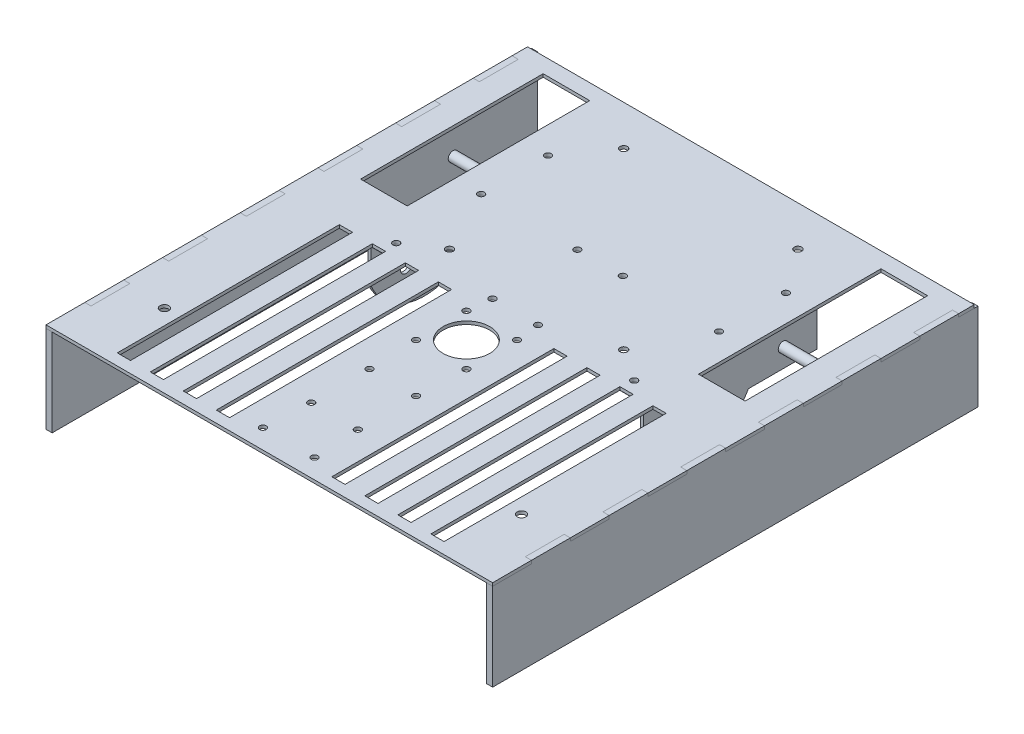
from build123d import *
from build123d.topology import SkipClean

# Parameters (mm, degrees)
SKETCH2_W           = 24
SKETCH2_H           = 94
BOSS_EXTRUDE1_DEPTH = 1.6
BOSS_EXTRUDE2_DEPTH = 3.175
BOSS_EXTRUDE3_DEPTH = 1.6129
SKETCH6_W           = 1.6129
SKETCH6_H           = 89.302300467
SKETCH6_R           = 1.27
SKETCH6_R_2         = 3
SKETCH6_R_3         = 2.55
BOSS_EXTRUDE4_DEPTH = 1.6129
SKETCH7_R           = 1.7
SKETCH7_R_2         = 1.9
SKETCH7_R_3         = 2.25
SKETCH7_W           = 6.810686888
SKETCH7_H           = 114.362783992
CUT_EXTRUDE1_DEPTH  = 10
SKETCH9_R           = 2.5
BOSS_EXTRUDE6_DEPTH = 189


with BuildPart() as part:
    # Sketch2 → Boss-Extrude1 (new body)
    with BuildSketch(Plane(origin=(0, 0, 0), x_dir=(1, 0, 0), z_dir=(0, 1, 0))):
        Polygon((-172.266187111, -88.214102909), (57.733812889, -88.214102909), (57.733812889, -68.214102909), (54.558812889, -68.214102909), (54.558812889, -48.214102909), (57.733812889, -48.214102909), (57.733812889, -28.214102909), (54.558812889, -28.214102909), (54.558812889, -8.214102909), (57.733812889, -8.214102909), (57.733812889, 11.785897091), (54.558812889, 11.785897091), (54.558812889, 31.785897091), (57.733812889, 31.785897091), (57.733812889, 51.785897091), (54.558812889, 51.785897091), (54.558812889, 71.785897091), (57.733812889, 71.785897091), (57.733812889, 91.785897091), (54.558812889, 91.785897091), (54.558812889, 111.785897091), (57.733812889, 111.785897091), (57.733812889, 131.785897091), (54.558812889, 131.785897091), (54.558812889, 151.785897091), (57.733812889, 151.785897091), (57.733812889, 159.785897091), (-172.266187111, 159.785897091), (-172.266187111, 151.785897091), (-169.091187111, 151.785897091), (-169.091187111, 131.785897091), (-172.266187111, 131.785897091), (-172.266187111, 111.785897091), (-169.091187111, 111.785897091), (-169.091187111, 91.785897091), (-172.266187111, 91.785897091), (-172.266187111, 71.785897091), (-169.091187111, 71.785897091), (-169.091187111, 51.785897091), (-172.266187111, 51.785897091), (-172.266187111, 31.785897091), (-169.091187111, 31.785897091), (-169.091187111, 11.785897091), (-172.266187111, 11.785897091), (-172.266187111, -8.214102909), (-169.091187111, -8.214102909), (-169.091187111, -28.214102909), (-172.266187111, -28.214102909), (-172.266187111, -48.214102909), (-169.091187111, -48.214102909), (-169.091187111, -68.214102909), (-172.266187111, -68.214102909), align=None)
        with Locations((29.733812889, 104.785897091)):
            Rectangle(SKETCH2_W, SKETCH2_H, mode=Mode.SUBTRACT)
        with Locations((-144.266187111, 104.785897091)):
            Rectangle(SKETCH2_W, SKETCH2_H, mode=Mode.SUBTRACT)
    extrude(amount=BOSS_EXTRUDE1_DEPTH)


with BuildPart() as body_2:
    # Sketch3 → Boss-Extrude2 (new body)
    with BuildSketch(Plane.ZY.offset(169.091187111)):
        Polygon((68.214102909, 1.6), (68.214102909, 0), (88.214102909, 0), (88.214102909, -45), (-161.732040232, -45), (-161.732040232, 0), (-151.785897091, 0), (-151.785897091, 1.6), (-131.785897091, 1.6), (-131.785897091, 0), (-111.785897091, 0), (-111.785897091, 1.6), (-91.785897091, 1.6), (-91.785897091, 0), (-71.785897091, 0), (-71.785897091, 1.6), (-51.785897091, 1.6), (-51.785897091, 0), (-31.785897091, 0), (-31.785897091, 1.6), (-11.785897091, 1.6), (-11.785897091, 0), (8.214102909, 0), (8.214102909, 1.6), (28.214102909, 1.6), (28.214102909, 0), (48.214102909, 0), (48.214102909, 1.6), align=None)
    extrude(amount=BOSS_EXTRUDE2_DEPTH)


with BuildPart() as body_3:
    # Sketch4 → Boss-Extrude3 (new body)
    with BuildSketch(Plane.XZ):
        Polygon((-128.266187111, -122.812619878), (-128.266187111, -33.510319411), (-110.428738975, -33.510319411), (-110.428738975, -55.404375385), (-73.179527552, -55.404375385), (-73.179527552, -32.986733746), (-64.765041143, -32.986733746), (-64.765041143, -87.177277304), (-73.179527552, -87.177277304), (-73.179527552, -65.404375385), (-110.42560363, -65.404375385), (-110.42560363, -122.812619878), align=None)
    extrude(amount=BOSS_EXTRUDE3_DEPTH)

    # Sketch6 → Boss-Extrude4 (add)
    # profile 1 of 3: a face of its own
    with BuildSketch(Plane(origin=(-128.266187111, 113.834921078, 0), x_dir=(0, -1, 0), z_dir=(1, 0, 0))):
        with Locations((114.641371078, 78.161469645)):
            Rectangle(SKETCH6_W, SKETCH6_H)
    # profile 2 of 3: a face of its own
    with BuildSketch(Plane(origin=(-128.266187111, 113.834921078, 0), x_dir=(0, -1, 0), z_dir=(1, 0, 0))):
        with BuildLine():
            Line((115.447821078, 122.812619878), (115.447821078, 33.510319411))
            Line((115.447821078, 33.510319411), (132.890035435, 33.510319411))
            ThreePointArc((132.890035435, 33.510319411), (151.205721227, 59.659542549), (135.588895095, 87.504846612))
            Line((135.588895095, 87.504846612), (135.588895095, 122.812619878))
            Line((135.588895095, 122.812619878), (115.447821078, 122.812619878))
        make_face()
        with Locations(Location((123.193301078, 51.685825385, 0), (0, 0, 270))):
            Circle(SKETCH6_R, mode=Mode.SUBTRACT)
        with Locations(Location((133.404101078, 51.685825385, 0), (0, 0, 270))):
            Circle(SKETCH6_R_2, mode=Mode.SUBTRACT)
        with Locations(Location((143.614901078, 51.685825385, 0), (0, 0, 270))):
            Circle(SKETCH6_R, mode=Mode.SUBTRACT)
        with Locations(Location((133.404101078, 73.860025385, 0), (0, 0, 270))):
            Circle(SKETCH6_R, mode=Mode.SUBTRACT)
        with Locations(Location((125.834921078, 105.412619878, 0), (0, 0, 270))):
            Circle(SKETCH6_R_3, mode=Mode.SUBTRACT)
    # profile 3 of 3: a face of its own
    with BuildSketch(Plane(origin=(-128.266187111, 113.834921078, 0), x_dir=(0, -1, 0), z_dir=(1, 0, 0))):
        with BuildLine():
            Line((115.447821078, 122.812619878), (115.447821078, 33.510319411))
            Line((115.447821078, 33.510319411), (132.890035435, 33.510319411))
            ThreePointArc((132.890035435, 33.510319411), (151.205721227, 59.659542549), (135.588895095, 87.504846612))
            Line((135.588895095, 87.504846612), (135.588895095, 122.812619878))
            Line((135.588895095, 122.812619878), (115.447821078, 122.812619878))
        make_face()
        with Locations(Location((123.193301078, 51.685825385, 0), (0, 0, 270))):
            Circle(SKETCH6_R, mode=Mode.SUBTRACT)
        with Locations(Location((133.404101078, 51.685825385, 0), (0, 0, 270))):
            Circle(SKETCH6_R_2, mode=Mode.SUBTRACT)
        with Locations(Location((143.614901078, 51.685825385, 0), (0, 0, 270))):
            Circle(SKETCH6_R, mode=Mode.SUBTRACT)
        with Locations(Location((133.404101078, 73.860025385, 0), (0, 0, 270))):
            Circle(SKETCH6_R, mode=Mode.SUBTRACT)
        with Locations(Location((125.834921078, 105.412619878, 0), (0, 0, 270))):
            Circle(SKETCH6_R_3, mode=Mode.SUBTRACT)
    extrude(amount=BOSS_EXTRUDE4_DEPTH)


with BuildPart() as cut_extrude1_tool:
    # Sketch7 → Cut-Extrude1 (new body)
    with BuildSketch(Plane.XZ.offset(1.6129)):
        with Locations(Location((-118.541013043, -82.124992621, 0), (0, 0, 270))):
            Circle(SKETCH7_R)
        with Locations(Location((-118.541013043, -38.429929163, 0), (0, 0, 270))):
            Circle(SKETCH7_R)
        with Locations(Location((-68.972284348, -38.429929163, 0), (0, 0, 270))):
            Circle(SKETCH7_R)
        with Locations(Location((-68.972284348, -82.124992621, 0), (0, 0, 270))):
            Circle(SKETCH7_R)
        with Locations(Location((-118.541013043, -116.547553094, 0), (0, 0, 270))):
            Circle(SKETCH7_R)
        with Locations(Location((-102.118387528, -49.429929163, 0), (0, 0, 270))):
            Circle(SKETCH7_R_2)
        with Locations(Location((-102.118387528, -139.129929163, 0), (0, 0, 270))):
            Circle(SKETCH7_R_2)
        with Locations(Location((-149.231187111, 50.285055474, 0), (0, 0, 270))):
            Circle(SKETCH7_R_3)
        with Locations(Location((-70.266187111, -0.279944526, 0), (0, 0, 270))):
            Circle(SKETCH7_R)
        with Locations(Location((-70.266187111, -26.279944526, 0), (0, 0, 270))):
            Circle(SKETCH7_R)
        with Locations(Location((-70.566187111, 78.214102909, 0), (0, 0, 270))):
            Circle(SKETCH7_R)
        with Locations(Location((-69.266187111, 24.634898886, 0), (0, 0, 270))):
            Circle(SKETCH7_R)
        with Locations(Location((-69.266187111, 54.634898886, 0), (0, 0, 270))):
            Circle(SKETCH7_R)
        with BuildLine():
            Line((-57.266187111, -1.279944526), (-57.266187111, -25.279944526))
            ThreePointArc((-57.266187111, -25.279944526), (-69.266187111, -13.279944526), (-57.266187111, -1.279944526))
        make_face()
        with Locations((-121.008693153, 25.186506321)):
            Rectangle(SKETCH7_W, SKETCH7_H)
        with Locations((-138.008693153, 25.186506321)):
            Rectangle(SKETCH7_W, SKETCH7_H)
        with Locations((-104.008693153, 25.186506321)):
            Rectangle(SKETCH7_W, SKETCH7_H)
        with Locations((-87.008693153, 25.186506321)):
            Rectangle(SKETCH7_W, SKETCH7_H)
    cut_extrude1 = extrude(amount=-CUT_EXTRUDE1_DEPTH)


with BuildPart() as part_1:
    add(part.part)

    # Cut-Extrude1: cut by cut_extrude1_tool
    add(cut_extrude1_tool.part, mode=Mode.SUBTRACT)

    # Mirror2: Cut-Extrude1 across plane
    with SkipClean():  # the faces are left unmerged after this step: merging them gives an invalid solid
        add(cut_extrude1.mirror(Plane.ZY.offset(57.266187111)), mode=Mode.SUBTRACT)


with BuildPart() as body_3_1:
    add(body_3.part)

    # Cut-Extrude1: cut by cut_extrude1_tool
    add(cut_extrude1_tool.part, mode=Mode.SUBTRACT)


with BuildPart() as body_4:
    # Mirror1: mirrored copy
    add(body_3_1.part.mirror(Plane.ZY.offset(57.266187111)))


with BuildPart() as body_5:
    # Mirror1 2: mirrored copy
    add(body_2.part.mirror(Plane.ZY.offset(57.266187111)))


with BuildPart() as body_6:
    # Sketch9 → Boss-Extrude6 (new body)
    with BuildSketch(Plane(origin=(-156.266187111, 0, 0), x_dir=(0, 0, -1), z_dir=(1, 0, 0))):
        with Locations((105.412619878, -12)):
            Circle(SKETCH9_R)
    extrude(amount=BOSS_EXTRUDE6_DEPTH)


solid = Compound([body_2.part, part_1.part, body_3_1.part, body_4.part, body_5.part, body_6.part])
